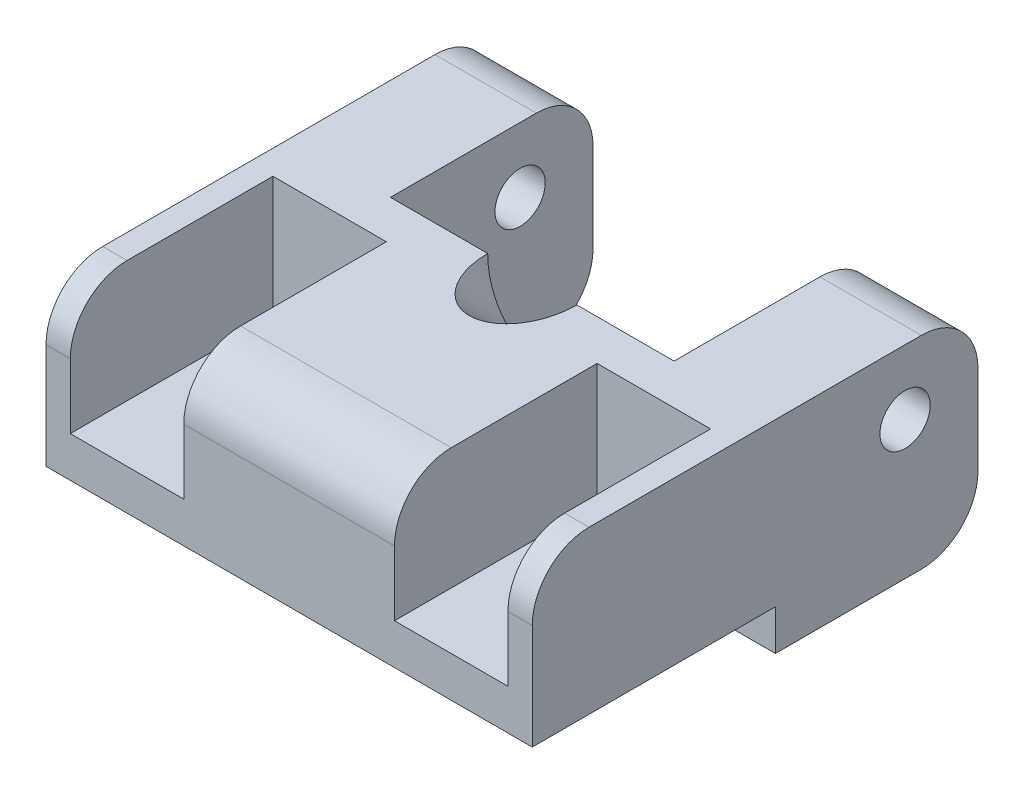
from build123d import *

# Parameters (mm, degrees)
CROQUIS1_R                   = 2.5
SALIENTE_EXTRUIR1_DEPTH      = 5
SALIENTE_EXTRUIR2_DEPTH      = 15
SALIENTE_EXTRUIR2_DEPTH_BACK = 10
CORTAR_EXTRUIR2_REACH        = 85.815
CROQUIS4_R                   = 3.1
CROQUIS4_W                   = 30
CROQUIS4_H                   = 5
REDONDEO2_R                  = 7
CORTAR_EXTRUIR3_DEPTH        = 10
CORTAR_EXTRUIR3_DEPTH_BACK   = 10
CROQUIS5_R                   = 5.5


with BuildPart() as part:
    # Croquis1 → Saliente-Extruir1 (new body)
    with BuildSketch(Plane(origin=(0, 0, 0), x_dir=(1, 0, 0), z_dir=(0, 1, 0))):
        Polygon((0, 0), (60, 0), (60, 30), (60, 55), (47.5, 55), (47.5, 30), (12.5, 30), (12.5, 55), (0, 55), (0, 30), align=None)
        with Locations(Location((10, 15, 0), (0, 0, 270))):
            Circle(CROQUIS1_R, mode=Mode.SUBTRACT)
        with Locations(Location((50, 15, 0), (0, 0, 270))):
            Circle(CROQUIS1_R, mode=Mode.SUBTRACT)
    extrude(amount=SALIENTE_EXTRUIR1_DEPTH)

    # Croquis2 → Saliente-Extruir2 (add, two sides: drawn at the far end of the back side and taken through both)
    with BuildSketch(Plane(origin=(0, 5, 0), x_dir=(1, 0, 0), z_dir=(0, 1, 0)).offset(-SALIENTE_EXTRUIR2_DEPTH_BACK)):
        Polygon((3, 0), (3, 25), (17, 25), (17, 0), (43, 0), (43, 25), (57, 25), (57, 0), (60, 0), (60, 55), (47.5, 55), (47.5, 30), (12.5, 30), (12.5, 55), (0, 55), (0, 0), align=None)
    extrude(amount=SALIENTE_EXTRUIR2_DEPTH + SALIENTE_EXTRUIR2_DEPTH_BACK)

    # Cortar-Extruir2: up to this face of the body (flat: up to its plane)
    cortar_extruir2_end = Plane(part.part.faces().sort_by_distance((60, 7.5, -27.5))[0])
    # Croquis4 → Cortar-Extruir2 (cut, up to the picked face)
    with BuildSketch(Plane.ZY, mode=Mode.PRIVATE) as cortar_extruir2_sk1:
        with Locations((-46, 12)):
            Circle(CROQUIS4_R)
    cortar_extruir2_tool1 = split(extrude(cortar_extruir2_sk1.sketch, amount=-CORTAR_EXTRUIR2_REACH, mode=Mode.PRIVATE), bisect_by=cortar_extruir2_end, keep=Keep.BOTH, mode=Mode.PRIVATE)
    # Croquis4 → Cortar-Extruir2 (cut, up to the picked face)
    with BuildSketch(Plane.ZY, mode=Mode.PRIVATE) as cortar_extruir2_sk2:
        with Locations((-15, -2.5)):
            Rectangle(CROQUIS4_W, CROQUIS4_H)
    cortar_extruir2_tool2 = split(extrude(cortar_extruir2_sk2.sketch, amount=-CORTAR_EXTRUIR2_REACH, mode=Mode.PRIVATE), bisect_by=cortar_extruir2_end, keep=Keep.BOTH, mode=Mode.PRIVATE)
    add(cortar_extruir2_tool1.solids().sort_by(Axis((0, 12, -46), (1, 0, 0)))[0], mode=Mode.SUBTRACT)
    add(cortar_extruir2_tool2.solids().sort_by(Axis((0, -2.5, -15), (1, 0, 0)))[0], mode=Mode.SUBTRACT)

    # Redondeo2
    redondeo2_edges = [part.edges().sort_by_distance(p)[0] for p in [
        (6.25, -5, -55),
        (53.75, -5, -55),
        (6.25, 20, -55),
        (1.5, 20, 0),
        (30, 20, 0),
        (58.5, 20, 0),
        (53.75, 20, -55),
    ]]
    fillet(redondeo2_edges, radius=REDONDEO2_R)

    # Croquis5 → Cortar-Extruir3 (cut, two sides: drawn at the far end of the back side and taken through both)
    with BuildSketch(Plane(origin=(0, -5, -5), x_dir=(-1, 0, 0), z_dir=(0, -0.7071067811865488, -0.7071067811865464)).offset(-CORTAR_EXTRUIR3_DEPTH_BACK)):
        with Locations((-30, 35.355339059)):
            Circle(CROQUIS5_R)
    extrude(amount=CORTAR_EXTRUIR3_DEPTH + CORTAR_EXTRUIR3_DEPTH_BACK, mode=Mode.SUBTRACT)


solid = part.part
